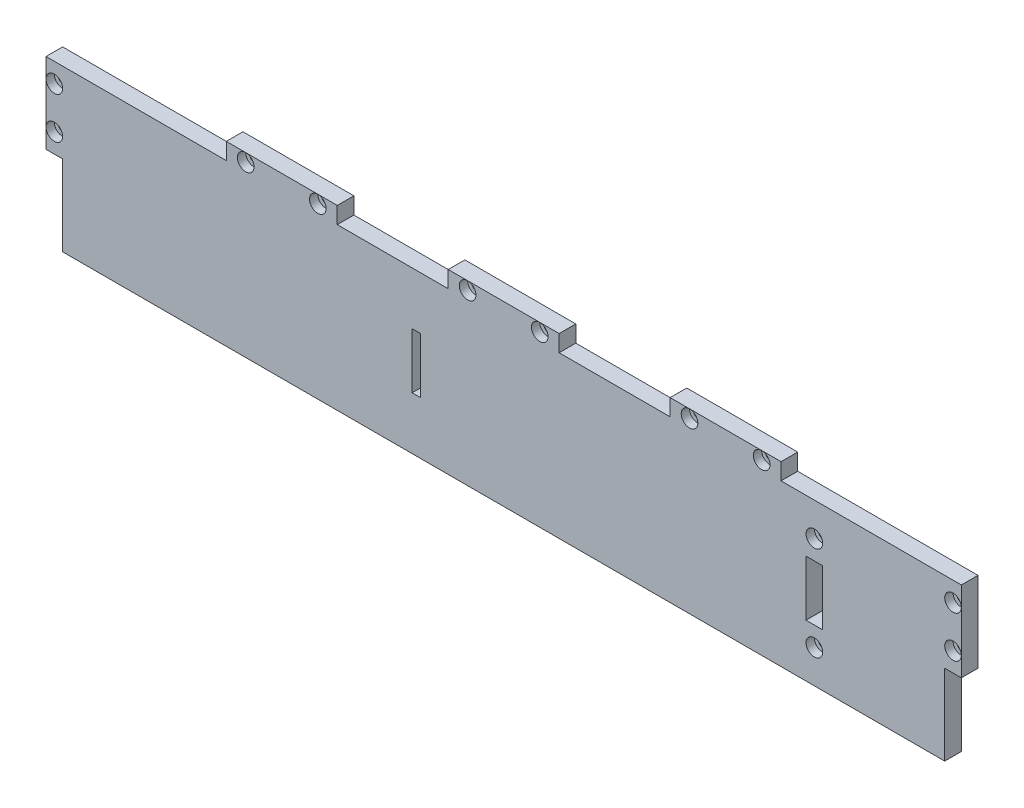
from build123d import *

# Parameters (mm, degrees)
ESQUISSE1_W             = 330
ESQUISSE1_H             = 64
BOSS_EXTRU_1_DEPTH      = 6
ESQUISSE2_W             = 65
ESQUISSE2_H             = 6
ESQUISSE2_W_2           = 40
ESQUISSE2_W_3           = 6
ESQUISSE2_H_2           = 29
ENL_V_MAT_EXTRU_1_DEPTH = 337.20232004
ESQUISSE3_W             = 3
ESQUISSE3_H             = 20
ESQUISSE3_W_2           = 6
ENL_V_MAT_EXTRU_2_DEPTH = 337.20232004
ESQUISSE4_R             = 1.5
ENL_V_MAT_EXTRU_3_DEPTH = 337.20232004
ESQUISSE5_R             = 2.995
ENL_V_MAT_EXTRU_4_DEPTH = 3


with BuildPart() as part:
    # Esquisse1 → Boss.-Extru.1 (new body)
    with BuildSketch(Plane.XY):
        with Locations((-165, 32)):
            Rectangle(ESQUISSE1_W, ESQUISSE1_H)
    extrude(amount=BOSS_EXTRU_1_DEPTH)

    # Esquisse2 → Enlèv. mat.-Extru.1 (cut, through all)
    with BuildSketch(Plane.XY.offset(6)):
        with Locations((-297.5, 61)):
            Rectangle(ESQUISSE2_W, ESQUISSE2_H)
        with Locations((-205, 61)):
            Rectangle(ESQUISSE2_W_2, ESQUISSE2_H)
        with Locations((-125, 61)):
            Rectangle(ESQUISSE2_W_2, ESQUISSE2_H)
        with Locations((-32.5, 61)):
            Rectangle(ESQUISSE2_W, ESQUISSE2_H)
        with Locations((-327, 14.5)):
            Rectangle(ESQUISSE2_W_3, ESQUISSE2_H_2)
        with Locations((-3, 14.5)):
            Rectangle(ESQUISSE2_W_3, ESQUISSE2_H_2)
    extrude(amount=-ENL_V_MAT_EXTRU_1_DEPTH, mode=Mode.SUBTRACT)

    # Esquisse3 → Enlèv. mat.-Extru.2 (cut, through all)
    with BuildSketch(Plane.XY.offset(6)):
        with Locations((-196.5, 29)):
            Rectangle(ESQUISSE3_W, ESQUISSE3_H)
        with Locations((-53, 29)):
            Rectangle(ESQUISSE3_W_2, ESQUISSE3_H)
    extrude(amount=-ENL_V_MAT_EXTRU_2_DEPTH, mode=Mode.SUBTRACT)

    # Esquisse4 → Enlèv. mat.-Extru.3 (cut, through all)
    with BuildSketch(Plane.XY.offset(6)):
        with Locations((-327, 51)):
            Circle(ESQUISSE4_R)
        with Locations((-327, 36)):
            Circle(ESQUISSE4_R)
        with Locations((-3, 36)):
            Circle(ESQUISSE4_R)
        with Locations((-258, 61)):
            Circle(ESQUISSE4_R)
        with Locations((-232, 61)):
            Circle(ESQUISSE4_R)
        with Locations((-178, 61)):
            Circle(ESQUISSE4_R)
        with Locations((-152, 61)):
            Circle(ESQUISSE4_R)
        with Locations((-98, 61)):
            Circle(ESQUISSE4_R)
        with Locations((-72, 61)):
            Circle(ESQUISSE4_R)
        with Locations((-53, 46)):
            Circle(ESQUISSE4_R)
        with Locations((-53, 12)):
            Circle(ESQUISSE4_R)
        with Locations((-3, 51)):
            Circle(ESQUISSE4_R)
    extrude(amount=-ENL_V_MAT_EXTRU_3_DEPTH, mode=Mode.SUBTRACT)

    # Esquisse5 → Enlèv. mat.-Extru.4 (cut)
    with BuildSketch(Plane.XY.offset(6)):
        with Locations((-3, 36)):
            Circle(ESQUISSE5_R)
        with Locations((-327, 36)):
            Circle(ESQUISSE5_R)
        with Locations((-327, 51)):
            Circle(ESQUISSE5_R)
        with Locations((-258, 61)):
            Circle(ESQUISSE5_R)
        with Locations((-232, 61)):
            Circle(ESQUISSE5_R)
        with Locations((-178, 61)):
            Circle(ESQUISSE5_R)
        with Locations((-152, 61)):
            Circle(ESQUISSE5_R)
        with Locations((-98, 61)):
            Circle(ESQUISSE5_R)
        with Locations((-72, 61)):
            Circle(ESQUISSE5_R)
        with Locations((-53, 46)):
            Circle(ESQUISSE5_R)
        with Locations((-53, 12)):
            Circle(ESQUISSE5_R)
        with Locations((-3, 51)):
            Circle(ESQUISSE5_R)
    extrude(amount=-ENL_V_MAT_EXTRU_4_DEPTH, mode=Mode.SUBTRACT)


solid = part.part
